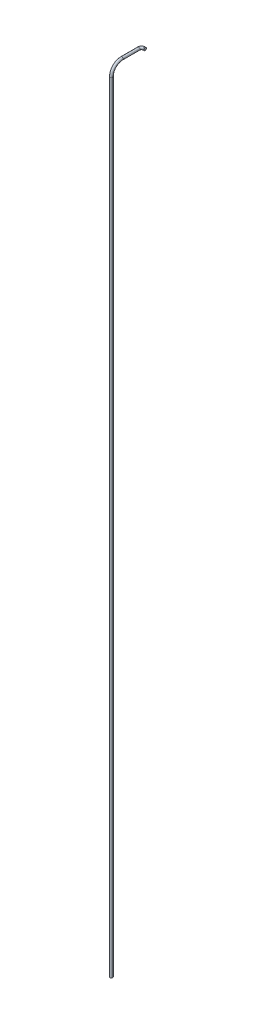
from build123d import *

# Parameters (mm, degrees)
VARREDURA1_PROFILE_R = 2.5
VARREDURA2_PROFILE_R = 2.5


with BuildPart() as part:
    # Varredura1: sweep along a path in Esboço1
    with BuildLine(Plane(origin=(0, 0, 0), x_dir=(0, 0, -1), z_dir=(1, 0, 0))) as varredura1_path:
        Line((0, 0), (-30, 0))
        ThreePointArc((-30, 0), (-44.142135624, -5.857864376), (-50, -20))
        Line((-50, -20), (-50, -1500))
    # Varredura1 profile (on start of the path) → Varredura1 (sweep)
    with BuildSketch(Plane(origin=(0, 0, 0), x_dir=(0, 1, 0), z_dir=(0, 0, 1))):
        Circle(VARREDURA1_PROFILE_R)
    sweep(path=varredura1_path.line)

    # Varredura2: sweep along a path in Esboço22
    with BuildLine(Plane(origin=(0, 0, 0), x_dir=(1, 0, 0), z_dir=(0, 1, 0))) as varredura2_path:
        Line((0, 0), (0, 2))
        ThreePointArc((0, 2), (1.464466094, 5.535533906), (5, 7))
        Line((5, 7), (6.99658834, 7))
    # Varredura2 profile (on start of the path) → Varredura2 (sweep)
    with BuildSketch(Plane(origin=(0, 0, 0), x_dir=(-1, 0, 0), z_dir=(0, 0, -1))):
        Circle(VARREDURA2_PROFILE_R)
    sweep(path=varredura2_path.line)


solid = part.part
